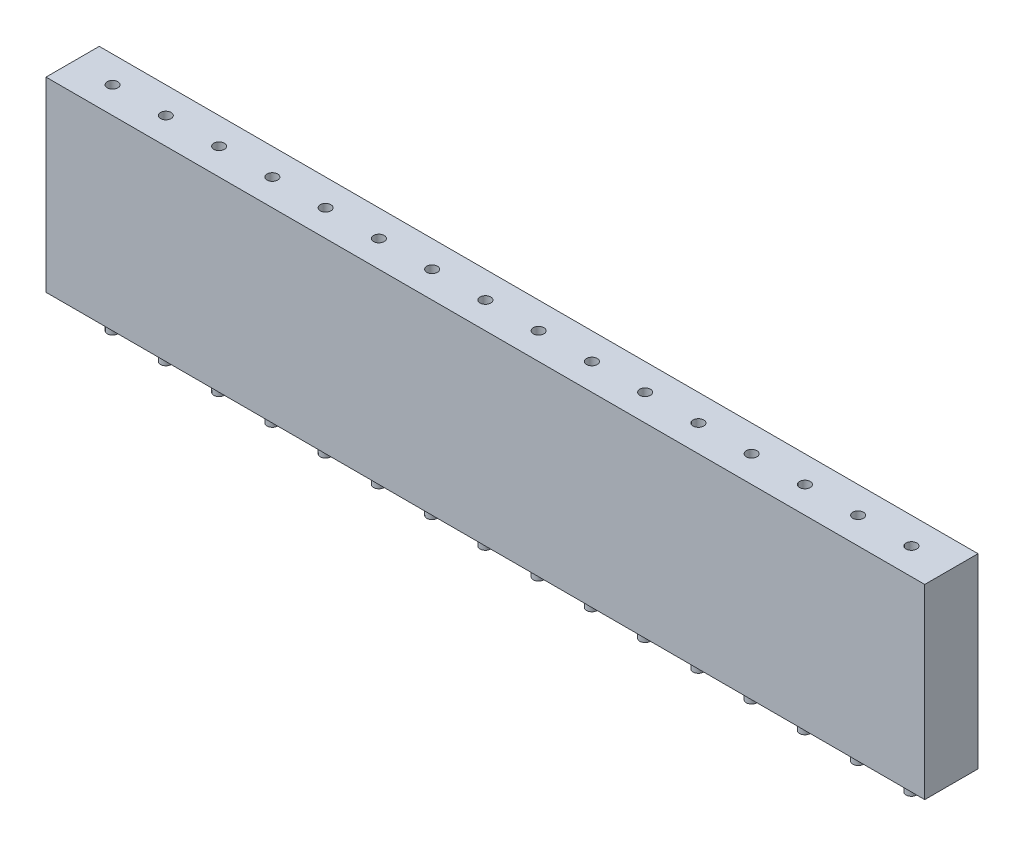
from build123d import *

# Parameters (mm, degrees)
SKETCH1_W      = 41.91
SKETCH1_H      = 2.54
EXTRUDE1_DEPTH = 8.89
SKETCH2_R      = 0.254
EXTRUDE2_DEPTH = 1.27
SKETCH3_R      = 0.254
EXTRUDE3_DEPTH = 2.54


with BuildPart() as part:
    # Sketch1 → Extrude1 (new body)
    with BuildSketch(Plane(origin=(0, 0, 0), x_dir=(1, 0, 0), z_dir=(0, 1, 0))):
        Rectangle(SKETCH1_W, SKETCH1_H)
    extrude(amount=EXTRUDE1_DEPTH)

    # Sketch2 → Extrude2 (add)
    with BuildSketch(Plane(origin=(0, 0, 0), x_dir=(1, 0, 0), z_dir=(0, 1, 0))):
        with Locations(Location((19.05, 0, 0), (0, 0, 270))):
            Circle(SKETCH2_R)
        with Locations(Location((16.51, 0, 0), (0, 0, 270))):
            Circle(SKETCH2_R)
        with Locations(Location((13.97, 0, 0), (0, 0, 270))):
            Circle(SKETCH2_R)
        with Locations(Location((11.43, 0, 0), (0, 0, 270))):
            Circle(SKETCH2_R)
        with Locations(Location((8.89, 0, 0), (0, 0, 270))):
            Circle(SKETCH2_R)
        with Locations(Location((6.35, 0, 0), (0, 0, 270))):
            Circle(SKETCH2_R)
        with Locations(Location((3.81, 0, 0), (0, 0, 270))):
            Circle(SKETCH2_R)
        with Locations(Location((1.27, 0, 0), (0, 0, 270))):
            Circle(SKETCH2_R)
        with Locations(Location((-1.27, 0, 0), (0, 0, 270))):
            Circle(SKETCH2_R)
        with Locations(Location((-3.81, 0, 0), (0, 0, 270))):
            Circle(SKETCH2_R)
        with Locations(Location((-6.35, 0, 0), (0, 0, 270))):
            Circle(SKETCH2_R)
        with Locations(Location((-8.89, 0, 0), (0, 0, 270))):
            Circle(SKETCH2_R)
        with Locations(Location((-11.43, 0, 0), (0, 0, 270))):
            Circle(SKETCH2_R)
        with Locations(Location((-13.97, 0, 0), (0, 0, 270))):
            Circle(SKETCH2_R)
        with Locations(Location((-16.51, 0, 0), (0, 0, 270))):
            Circle(SKETCH2_R)
        with Locations(Location((-19.05, 0, 0), (0, 0, 270))):
            Circle(SKETCH2_R)
    extrude(amount=-EXTRUDE2_DEPTH)

    # Sketch3 → Extrude3 (cut)
    with BuildSketch(Plane(origin=(0, 8.89, 0), x_dir=(1, 0, 0), z_dir=(0, 1, 0))):
        with Locations(Location((6.35, 0, 0), (0, 0, 270))):
            Circle(SKETCH3_R)
        with Locations(Location((8.89, 0, 0), (0, 0, 270))):
            Circle(SKETCH3_R)
        with Locations(Location((11.43, 0, 0), (0, 0, 270))):
            Circle(SKETCH3_R)
        with Locations(Location((13.97, 0, 0), (0, 0, 270))):
            Circle(SKETCH3_R)
        with Locations(Location((16.51, 0, 0), (0, 0, 270))):
            Circle(SKETCH3_R)
        with Locations(Location((19.05, 0, 0), (0, 0, 270))):
            Circle(SKETCH3_R)
        with Locations(Location((-13.97, 0, 0), (0, 0, 270))):
            Circle(SKETCH3_R)
        with Locations(Location((-11.43, 0, 0), (0, 0, 270))):
            Circle(SKETCH3_R)
        with Locations(Location((-8.89, 0, 0), (0, 0, 270))):
            Circle(SKETCH3_R)
        with Locations(Location((-6.35, 0, 0), (0, 0, 270))):
            Circle(SKETCH3_R)
        with Locations(Location((-3.81, 0, 0), (0, 0, 270))):
            Circle(SKETCH3_R)
        with Locations(Location((-1.27, 0, 0), (0, 0, 270))):
            Circle(SKETCH3_R)
        with Locations(Location((1.27, 0, 0), (0, 0, 270))):
            Circle(SKETCH3_R)
        with Locations(Location((3.81, 0, 0), (0, 0, 270))):
            Circle(SKETCH3_R)
        with Locations(Location((-19.05, 0, 0), (0, 0, 270))):
            Circle(SKETCH3_R)
        with Locations(Location((-16.51, 0, 0), (0, 0, 270))):
            Circle(SKETCH3_R)
    extrude(amount=-EXTRUDE3_DEPTH, mode=Mode.SUBTRACT)


solid = part.part
